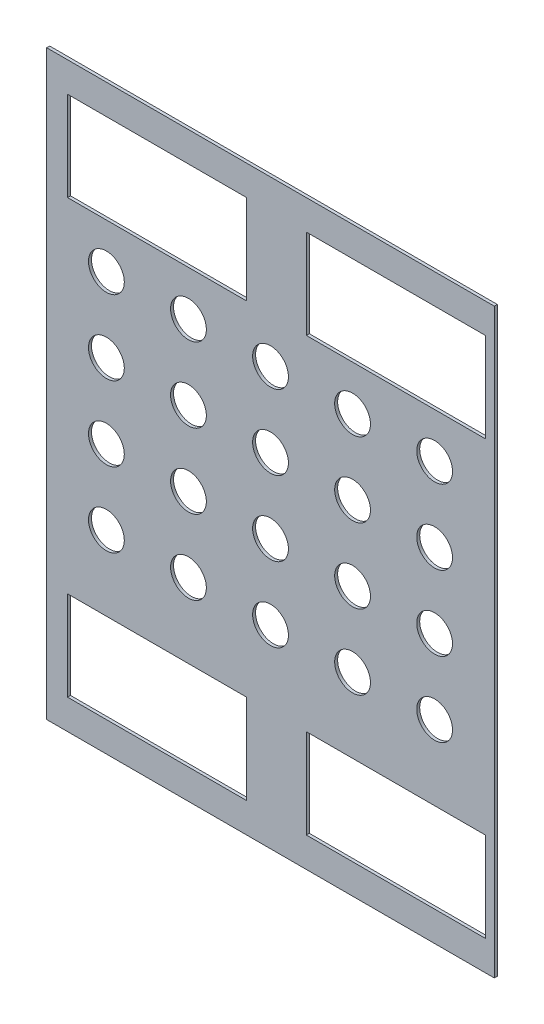
from build123d import *

# Parameters (mm, degrees)
SKETCH1_W           = 150
SKETCH1_H           = 195
SKETCH1_W_2         = 60
SKETCH1_H_2         = 30
BOSS_EXTRUDE1_DEPTH = 1
SKETCH2_R           = 6
CUT_EXTRUDE1_DEPTH  = 2


with BuildPart() as part:
    # Sketch1 → Boss-Extrude1 (new body)
    with BuildSketch(Plane.XY):
        with Locations((80.10402455, 77.161264357)):
            Rectangle(SKETCH1_W, SKETCH1_H)
        with Locations((42.10402455, 149.661264357)):
            Rectangle(SKETCH1_W_2, SKETCH1_H_2, mode=Mode.SUBTRACT)
        with Locations((122.10402455, 149.661264357)):
            Rectangle(SKETCH1_W_2, SKETCH1_H_2, mode=Mode.SUBTRACT)
        with Locations((42.10402455, 4.661264357)):
            Rectangle(SKETCH1_W_2, SKETCH1_H_2, mode=Mode.SUBTRACT)
        with Locations((122.10402455, 4.661264357)):
            Rectangle(SKETCH1_W_2, SKETCH1_H_2, mode=Mode.SUBTRACT)
    extrude(amount=BOSS_EXTRUDE1_DEPTH)

    # Sketch2 → Cut-Extrude1 (cut)
    with BuildSketch(Plane.XY.offset(1)):
        with Locations((25.10402455, 119.661264357)):
            Circle(SKETCH2_R)
        with Locations((25.10402455, 94.661264357)):
            Circle(SKETCH2_R)
        with Locations((25.10402455, 69.661264357)):
            Circle(SKETCH2_R)
        with Locations((25.10402455, 44.661264357)):
            Circle(SKETCH2_R)
        with Locations((52.60402455, 119.661264357)):
            Circle(SKETCH2_R)
        with Locations((52.60402455, 69.661264357)):
            Circle(SKETCH2_R)
        with Locations((52.60402455, 94.661264357)):
            Circle(SKETCH2_R)
        with Locations((52.60402455, 44.661264357)):
            Circle(SKETCH2_R)
        with Locations((80.10402455, 119.661264357)):
            Circle(SKETCH2_R)
        with Locations((80.10402455, 69.661264357)):
            Circle(SKETCH2_R)
        with Locations((80.10402455, 94.661264357)):
            Circle(SKETCH2_R)
        with Locations((80.10402455, 44.661264357)):
            Circle(SKETCH2_R)
        with Locations((107.60402455, 119.661264357)):
            Circle(SKETCH2_R)
        with Locations((107.60402455, 69.661264357)):
            Circle(SKETCH2_R)
        with Locations((107.60402455, 94.661264357)):
            Circle(SKETCH2_R)
        with Locations((107.60402455, 44.661264357)):
            Circle(SKETCH2_R)
        with Locations((135.10402455, 119.661264357)):
            Circle(SKETCH2_R)
        with Locations((135.10402455, 69.661264357)):
            Circle(SKETCH2_R)
        with Locations((135.10402455, 94.661264357)):
            Circle(SKETCH2_R)
        with Locations((135.10402455, 44.661264357)):
            Circle(SKETCH2_R)
    extrude(amount=-CUT_EXTRUDE1_DEPTH, mode=Mode.SUBTRACT)


solid = part.part
